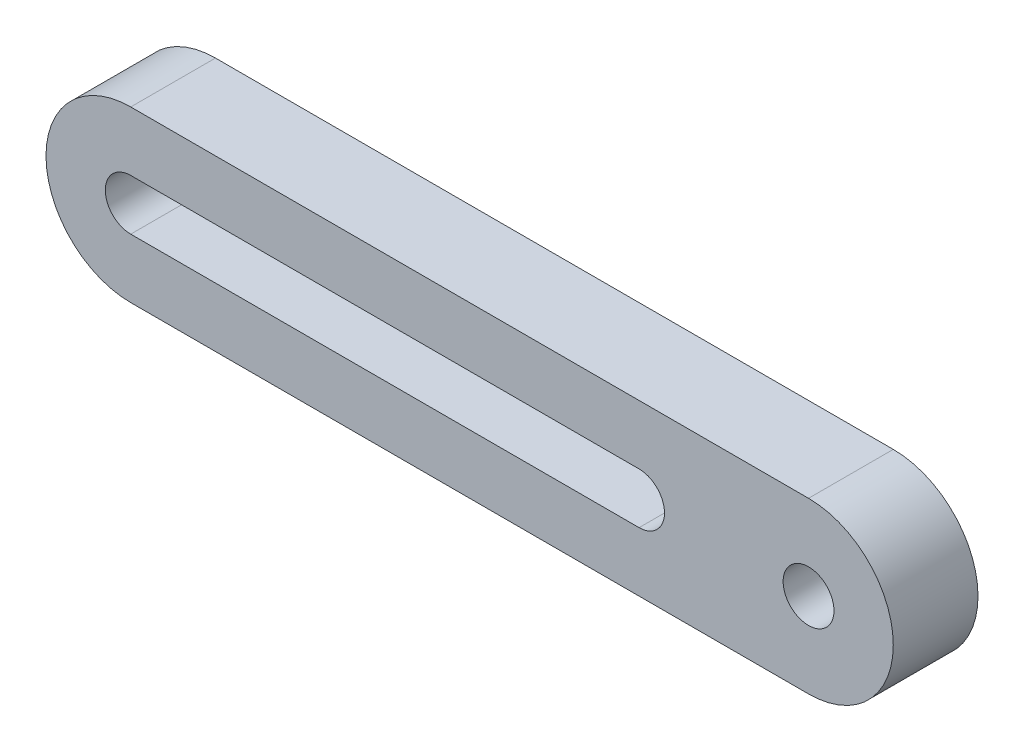
from build123d import *

# Parameters (mm, degrees)
SKETCH1_R           = 1.5
BOSS_EXTRUDE2_DEPTH = 5


with BuildPart() as part:
    # Sketch1 → Boss-Extrude2 (new body)
    with BuildSketch(Plane.XY):
        with BuildLine():
            Line((-30, 5), (10, 5))
            ThreePointArc((10, 5), (15, 0), (10, -5))
            Line((10, -5), (-30, -5))
            ThreePointArc((-30, -5), (-35, 0), (-30, 5))
        make_face()
        with Locations((10, 0)):
            Circle(SKETCH1_R, mode=Mode.SUBTRACT)
        with BuildLine():
            Line((-30, 1.5), (0, 1.5))
            ThreePointArc((0, 1.5), (1.5, 0), (0, -1.5))
            Line((0, -1.5), (-30, -1.5))
            ThreePointArc((-30, -1.5), (-31.5, 0), (-30, 1.5))
        make_face(mode=Mode.SUBTRACT)
    extrude(amount=BOSS_EXTRUDE2_DEPTH)


solid = part.part
